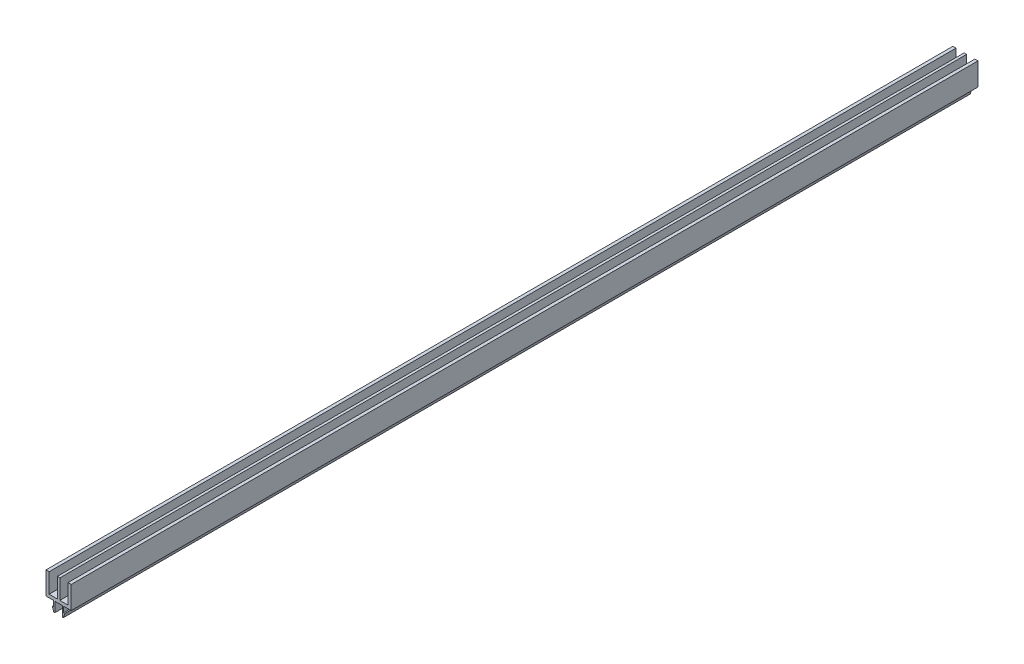
from build123d import *

# Parameters (mm, degrees)
BOSS_EXTRU_1_DEPTH = 720


with BuildPart() as part:
    # Esquisse1 → Boss.-Extru.1 (new body)
    with BuildSketch(Plane.XY.offset(50)):
        Polygon((-1, 2.5), (-7.5, 2.5), (-7.5, 17.999999998), (-10, 17.999999998), (-10, 0), (-4, 0), (-4, -4.5), (-5, -4.5), (-3.75, -8), (-3, -8), (-3, 0), (3, 0), (3, -8), (3.75, -8), (5, -4.5), (4, -4.5), (4, 0), (10, 0), (10, 17.999999998), (7.5, 17.999999998), (7.5, 2.5), (1, 2.5), (1, 17.999999998), (-1, 17.999999998), align=None)
    extrude(amount=-BOSS_EXTRU_1_DEPTH)


solid = part.part
